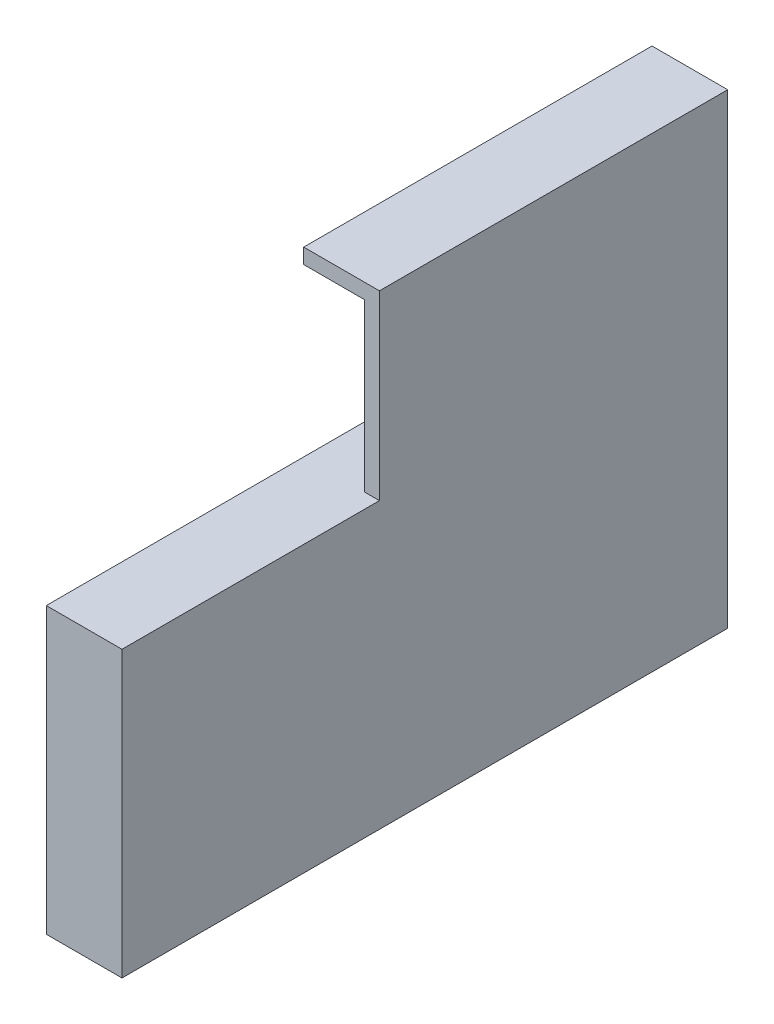
from build123d import *

# Parameters (mm, degrees)
SKETCH1_W                = 95
SKETCH1_H                = 42
BOSS_EXTRUDE2_DEPTH      = 2.5
EXTRUDE_THIN1_DEPTH      = 2.5
EXTRUDE_THIN1_DEPTH_BACK = 10
SKETCH1_2_W              = 100
SKETCH1_2_H              = 47
SKETCH1_2_W_2            = 95
SKETCH1_2_H_2            = 42
BOSS_EXTRUDE3_DEPTH      = 12.5
SKETCH2_4_W              = 55
SKETCH2_4_H              = 27.5
BOSS_EXTRUDE4_DEPTH      = 2.5


with BuildPart() as part:
    # Sketch1 → Boss-Extrude2 (new body)
    with BuildSketch(Plane(origin=(0, 0, 0), x_dir=(0, 0, -1), z_dir=(1, 0, 0))):
        with Locations((47.5, 21)):
            Rectangle(SKETCH1_W, SKETCH1_H)
    extrude(amount=BOSS_EXTRUDE2_DEPTH)

    # Sketch1<2> → Extrude-Thin1 (add, two sides: drawn at the far end of the back side and taken through both)
    with BuildSketch(Plane(origin=(0, 0, 0), x_dir=(0, 0, -1), z_dir=(1, 0, 0)).offset(-EXTRUDE_THIN1_DEPTH_BACK)):
        with Locations((47.5, 21)):
            Rectangle(SKETCH1_2_W, SKETCH1_2_H)
        with Locations((47.5, 21)):
            Rectangle(SKETCH1_2_W_2, SKETCH1_2_H_2, mode=Mode.SUBTRACT)
    extrude(amount=EXTRUDE_THIN1_DEPTH + EXTRUDE_THIN1_DEPTH_BACK)

    # Sketch2 → Boss-Extrude3 (add)
    with BuildSketch(Plane(origin=(2.5, 0, 0), x_dir=(0, 0, -1), z_dir=(1, 0, 0))):
        Polygon((95, 44.5), (97.5, 44.5), (97.5, 74.5), (40, 74.5), (40, 72), (95, 72), align=None)
    extrude(amount=-BOSS_EXTRUDE3_DEPTH)

    # Sketch2<4> → Boss-Extrude4 (add)
    with BuildSketch(Plane(origin=(2.5, 0, 0), x_dir=(0, 0, -1), z_dir=(1, 0, 0))):
        with Locations((67.5, 58.25)):
            Rectangle(SKETCH2_4_W, SKETCH2_4_H)
    extrude(amount=-BOSS_EXTRUDE4_DEPTH)


solid = part.part
